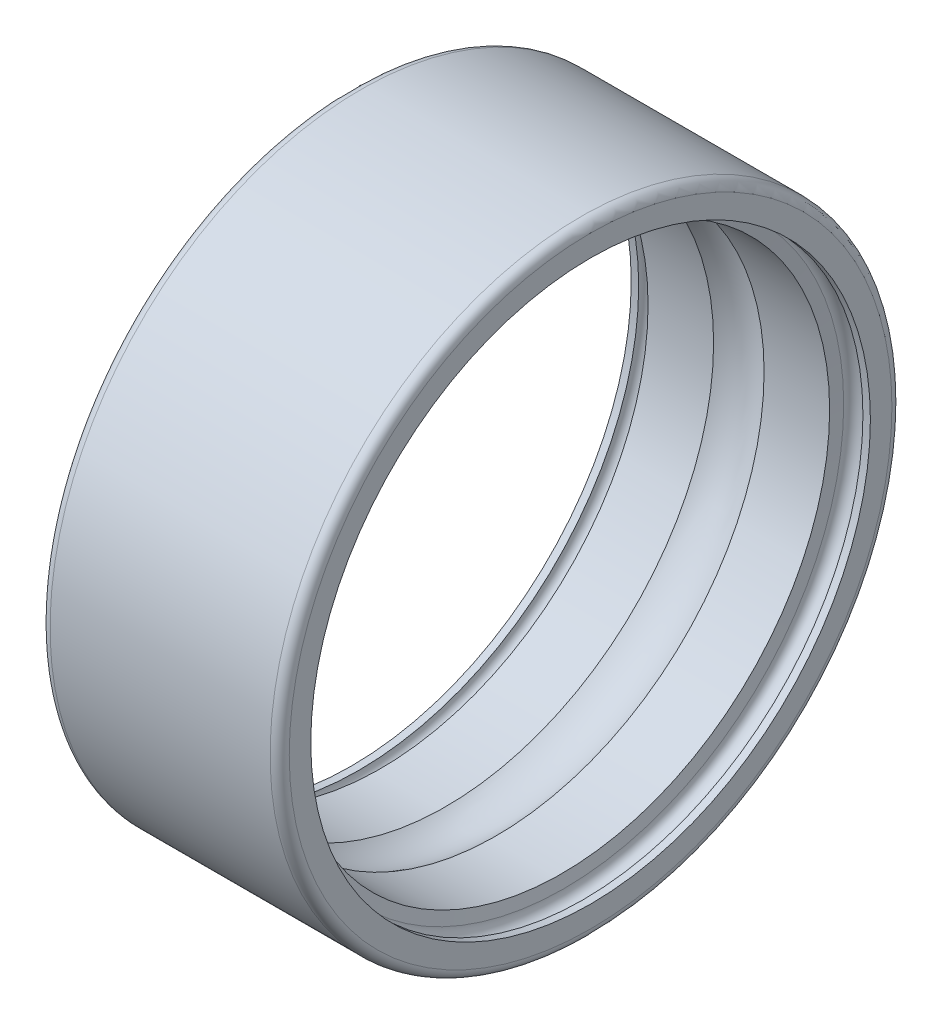
from build123d import *


with BuildPart() as part:
    # Sketch1 → Revolve1 (revolve)
    with BuildSketch(Plane.XY, mode=Mode.PRIVATE) as revolve1_sk:
        with BuildLine():
            Line((0, 5.85), (0.156, 5.85))
            ThreePointArc((0.156, 5.85), (0.357, 6.051), (0.558, 5.85))
            Line((0.558, 5.85), (0.602081745, 5.6))
            Line((0.602081745, 5.6), (1.972303117, 5.6))
            ThreePointArc((1.972303117, 5.6), (2.5, 5.752), (3.027696883, 5.6))
            Line((3.027696883, 5.6), (4.397918255, 5.6))
            Line((4.397918255, 5.6), (4.442, 5.85))
            ThreePointArc((4.442, 5.85), (4.643, 6.051), (4.844, 5.85))
            Line((4.844, 5.85), (5, 5.85))
            Line((5, 5.85), (5, 6.3))
            ThreePointArc((5, 6.3), (4.941421356, 6.441421356), (4.8, 6.5))
            Line((4.8, 6.5), (0.2, 6.5))
            ThreePointArc((0.2, 6.5), (0.058578644, 6.441421356), (0, 6.3))
            Line((0, 6.3), (0, 5.85))
        make_face()
    revolve(revolve1_sk.sketch.rotate(Axis((4.8, 0, 0), (-1, 0, 0)), 90), axis=Axis((4.8, 0, 0), (-1, 0, 0)))


solid = part.part
